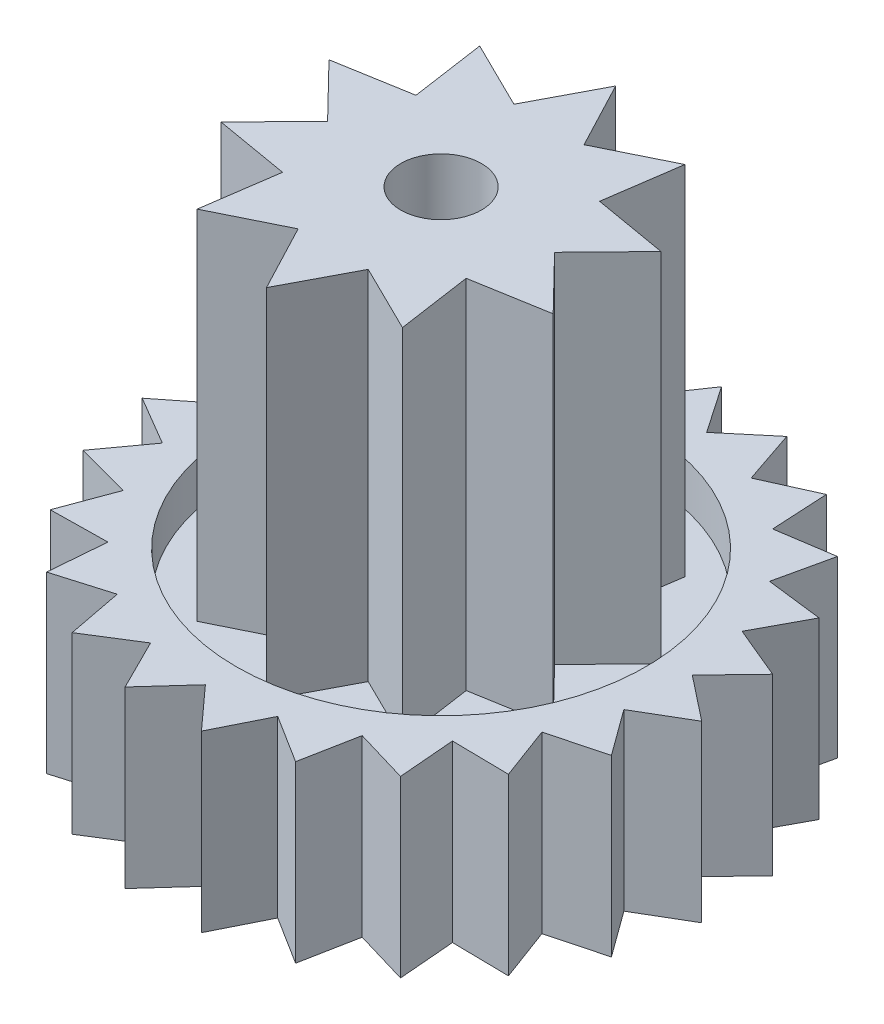
from build123d import *

# Parameters (mm, degrees)
SKETCH2_R          = 6.925
CUT_EXTRUDE1_DEPTH = 12.580744795
SKETCH3_R          = 4.5
CUT_EXTRUDE2_DEPTH = 8.18
SKETCH4_R          = 0.925
CUT_EXTRUDE3_DEPTH = 15.400048785


with BuildPart() as part:
    # Sketch1 → Revolve1 (revolve)
    with BuildSketch(Plane.XY, mode=Mode.PRIVATE) as revolve1_sk:
        Polygon((0, 11.18), (0, 0), (1.73, 0), (1.73, 1.44), (4.69, 1.44), (4.69, 0), (6.425, 0), (6.425, 4), (4.69, 4), (4.69, 3), (4, 3), (4, 11.18), align=None)
    revolve(revolve1_sk.sketch.rotate(Axis((0, 11.18, 0), (0, -1, 0)), 90), axis=Axis((0, 11.18, 0), (0, -1, 0)))

    # Sketch2 → Cut-Extrude1 (cut, through all)
    with BuildSketch(Plane(origin=(0, 4, 0), x_dir=(1, 0, 0), z_dir=(0, 1, 0))):
        Circle(SKETCH2_R)
        Polygon((0, 6.425), (-0.735299905, 5.349704109), (-1.733444255, 6.186743571), (-2.151365885, 4.952941028), (-3.338326879, 5.489644674), (-3.407874899, 4.18884097), (-4.69562107, 4.385403945), (-4.411637422, 3.114073739), (-5.704662528, 2.955917867), (-5.088208979, 1.808349906), (-6.290615263, 1.307204884), (-5.387411354, 0.368509032), (-6.410021842, -0.438457506), (-5.287054073, -1.09866247), (-6.054026425, -2.151601508), (-4.794580179, -2.484351204), (-5.249031563, -3.70517107), (-3.946514207, -3.685786973), (-4.054740042, -4.983945043), (-2.80575333, -4.613864785), (-2.559727002, -5.893082612), (-1.456902564, -5.199753352), (-0.87487072, -6.365157203), (0, -5.4), (0.87487072, -6.365157203), (1.456902564, -5.199753352), (2.559727002, -5.893082612), (2.80575333, -4.613864785), (4.054740042, -4.983945043), (3.946514207, -3.685786973), (5.249031563, -3.70517107), (4.794580179, -2.484351204), (6.054026425, -2.151601508), (5.287054073, -1.09866247), (6.410021842, -0.438457506), (5.387411354, 0.368509032), (6.290615263, 1.307204884), (5.088208979, 1.808349906), (5.704662528, 2.955917867), (4.411637422, 3.114073739), (4.69562107, 4.385403945), (3.407874899, 4.18884097), (3.338326879, 5.489644674), (2.151365885, 4.952941028), (1.733444255, 6.186743571), (0.735299905, 5.349704109), align=None, mode=Mode.SUBTRACT)
    extrude(amount=-CUT_EXTRUDE1_DEPTH, mode=Mode.SUBTRACT)

    # Sketch3 → Cut-Extrude2 (cut)
    with BuildSketch(Plane(origin=(0, 11.18, 0), x_dir=(1, 0, 0), z_dir=(0, 1, 0))):
        Circle(SKETCH3_R)
        Polygon((0, 4), (-0.803444185, 2.472746942), (-2.351141009, 3.236067977), (-2.103444185, 1.528241656), (-3.804226065, 1.236067977), (-2.6, 0), (-3.804226065, -1.236067977), (-2.103444185, -1.528241656), (-2.351141009, -3.236067977), (-0.803444185, -2.472746942), (0, -4), (0.803444185, -2.472746942), (2.351141009, -3.236067977), (2.103444185, -1.528241656), (3.804226065, -1.236067977), (2.6, 0), (3.804226065, 1.236067977), (2.103444185, 1.528241656), (2.351141009, 3.236067977), (0.803444185, 2.472746942), align=None, mode=Mode.SUBTRACT)
    extrude(amount=-CUT_EXTRUDE2_DEPTH, mode=Mode.SUBTRACT)

    # Sketch4 → Cut-Extrude3 (cut, through all)
    with BuildSketch(Plane(origin=(0, 11.18, 0), x_dir=(1, 0, 0), z_dir=(0, 1, 0))):
        with Locations(Location((0, 0, 0), (0, 0, 270))):
            Circle(SKETCH4_R)
    extrude(amount=-CUT_EXTRUDE3_DEPTH, mode=Mode.SUBTRACT)


solid = part.part
